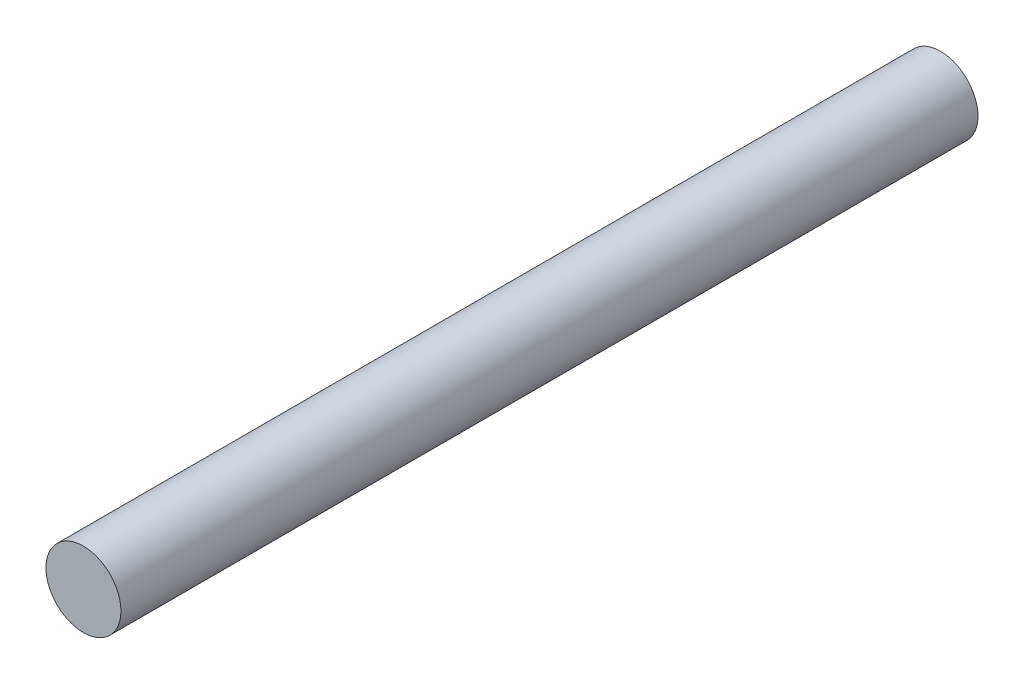
from build123d import *

# Parameters (mm, degrees)
SKIZZE1_R                       = 0.525
AUFSATZ_LINEAR_AUSTRAGEN1_DEPTH = 12


with BuildPart() as part:
    # Skizze1 → Aufsatz-Linear austragen1 (new body)
    with BuildSketch(Plane.XY):
        Circle(SKIZZE1_R)
    extrude(amount=AUFSATZ_LINEAR_AUSTRAGEN1_DEPTH)


solid = part.part
